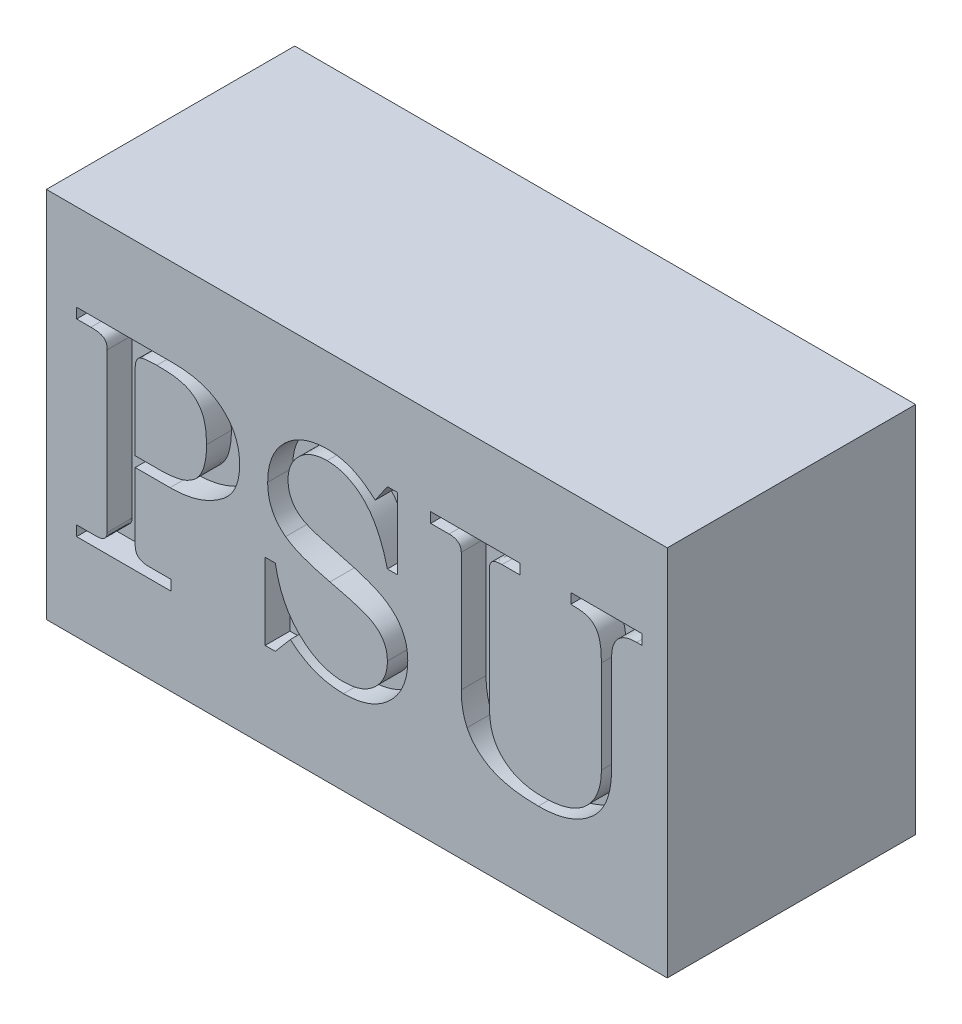
from build123d import *

# Parameters (mm, degrees)
SKETCH1_W           = 125
SKETCH1_H           = 75
BOSS_EXTRUDE1_DEPTH = 50
CUT_EXTRUDE1_DEPTH  = 5


with BuildPart() as part:
    # Sketch1 → Boss-Extrude1 (new body)
    with BuildSketch(Plane.XY):
        Rectangle(SKETCH1_W, SKETCH1_H)
    extrude(amount=BOSS_EXTRUDE1_DEPTH)

    # Sketch2 → Cut-Extrude1 (cut)
    # profile 1 of 3: a face of its own
    with BuildSketch(Plane.XY.offset(50)):
        with BuildLine():
            Line((-56.41025641, 20), (-37.051282051, 20))
            add(Edge.make_bspline(
                [(-37.051282051, 20), (-36.52204216, 19.991527784), (-35.490884744, 19.975020737), (-33.994972237, 19.825630845), (-32.591076027, 19.602688421), (-31.290520247, 19.260853532), (-30.077955268, 18.843022159), (-28.969795206, 18.308646834), (-27.949921272, 17.692552045), (-27.038002375, 16.976842451), (-26.224700836, 16.189326557), (-25.516807248, 15.338512692), (-24.916249962, 14.426315913), (-24.436149481, 13.449757313), (-24.057757456, 12.418278357), (-23.784279991, 11.331135117), (-23.62218601, 10.183833858), (-23.60072252, 9.399564299), (-23.58974359, 8.998397436)],
                knots=[0, 0, 0, 0, 1.292689141, 2.518642334, 3.669783171, 4.7619039, 5.800070599, 6.798316487, 7.761940572, 8.705739108, 9.624107705, 10.523144994, 11.404602814, 12.285964004, 13.175788456, 14.084273311, 15.020074082, 16, 16, 16, 16], degree=3))
            add(Edge.make_bspline(
                [(-23.58974359, 8.998397436), (-23.597484885, 8.599852888), (-23.612509178, 7.826358315), (-23.771679417, 6.702590675), (-24.014646482, 5.651465182), (-24.362474831, 4.669656315), (-24.808778623, 3.759197231), (-25.370177642, 2.929600928), (-26.0195377, 2.165855701), (-26.524459602, 1.727340303), (-26.778846154, 1.506410256)],
                knots=[0, 0, 0, 0, 1.133338588, 2.199581585, 3.222697031, 4.198656778, 5.157148606, 6.099382043, 7.042442712, 8, 8, 8, 8], degree=3))
            add(Edge.make_bspline(
                [(-26.778846154, 1.506410256), (-27.150358384, 1.221318352), (-27.889165368, 0.654370958), (-29.08946605, -0.066788228), (-30.346137315, -0.689408593), (-31.678214602, -1.181553109), (-33.064223912, -1.579982025), (-34.519212096, -1.845841348), (-36.034691561, -2.021242066), (-37.069466616, -2.041149449), (-37.596153846, -2.051282051)],
                knots=[0, 0, 0, 0, 0.966766413, 1.922557917, 2.887448627, 3.860055254, 4.852203204, 5.862987951, 6.912288278, 8, 8, 8, 8], degree=3))
            Line((-37.596153846, -2.051282051), (-44.615384615, -2.051282051))
            Line((-44.615384615, -2.051282051), (-44.615384615, -15.608974359))
            add(Edge.make_bspline(
                [(-44.615384615, -15.608974359), (-44.612226988, -15.794274025), (-44.60634347, -16.139537602), (-44.487520996, -16.611605986), (-44.322036005, -17.015015676), (-44.135541138, -17.213093638), (-44.046474359, -17.307692308)],
                knots=[0, 0, 0, 0, 1.202782543, 2.241110373, 3.159984198, 4, 4, 4, 4], degree=3))
            add(Edge.make_bspline(
                [(-44.046474359, -17.307692308), (-43.911046597, -17.407048231), (-43.637174192, -17.607973397), (-43.147060372, -17.807637756), (-42.596808011, -17.92855606), (-42.206893462, -17.941799617), (-42.003205128, -17.948717949)],
                knots=[0, 0, 0, 0, 0.919900139, 1.860292609, 2.882233465, 4, 4, 4, 4], degree=3))
            Line((-42.003205128, -17.948717949), (-37.435897436, -17.948717949))
            Line((-37.435897436, -17.948717949), (-37.435897436, -20))
            Line((-37.435897436, -20), (-56.41025641, -20))
            Line((-56.41025641, -20), (-56.41025641, -17.948717949))
            Line((-56.41025641, -17.948717949), (-52.5, -17.948717949))
            add(Edge.make_bspline(
                [(-52.5, -17.948717949), (-52.31788663, -17.942981092), (-51.977945195, -17.932272402), (-51.508127412, -17.844687399), (-51.109883004, -17.706842046), (-50.798290496, -17.48857499), (-50.548139659, -17.230180927), (-50.382835969, -16.917682521), (-50.269295945, -16.5702672), (-50.260834083, -16.32311856), (-50.256410256, -16.193910256)],
                knots=[0, 0, 0, 0, 1.349292458, 2.518653158, 3.534106056, 4.446148465, 5.31500813, 6.175016702, 7.045906153, 8, 8, 8, 8], degree=3))
            Line((-50.256410256, -16.193910256), (-50.256410256, 15.649038462))
            add(Edge.make_bspline(
                [(-50.256410256, 15.649038462), (-50.262284827, 15.839474251), (-50.273284612, 16.196053973), (-50.400606449, 16.690389687), (-50.621940945, 17.100165281), (-50.94382327, 17.430681636), (-51.388912675, 17.679735227), (-51.975742244, 17.835364377), (-52.704762346, 17.936923809), (-53.242075145, 17.944569131), (-53.533653846, 17.948717949)],
                knots=[0, 0, 0, 0, 0.983869924, 1.842238094, 2.61559018, 3.368282424, 4.198128383, 5.221597183, 6.492269143, 8, 8, 8, 8], degree=3))
            Line((-53.533653846, 17.948717949), (-56.41025641, 17.948717949))
            Line((-56.41025641, 17.948717949), (-56.41025641, 20))
        make_face()
        with BuildLine():
            Line((-44.615384615, 0), (-39.471153846, 0))
            add(Edge.make_bspline(
                [(-39.471153846, 0), (-39.078206802, 0.004663788), (-38.31753487, 0.01369201), (-37.22115155, 0.124773701), (-36.20612679, 0.275157138), (-35.279619803, 0.511489078), (-34.432482622, 0.801304037), (-33.677385038, 1.173604138), (-33.000162855, 1.599546214), (-32.405821351, 2.100917111), (-31.897341142, 2.689261368), (-31.452431883, 3.35343281), (-31.075101004, 4.103848888), (-30.771637798, 4.943434587), (-30.544007627, 5.868255157), (-30.377635393, 6.875492252), (-30.270824606, 7.96779391), (-30.261331436, 8.725698369), (-30.256410256, 9.118589744)],
                knots=[0, 0, 0, 0, 1.251897863, 2.423439953, 3.509527115, 4.51918943, 5.466945524, 6.357863163, 7.196225829, 8.011580449, 8.826045721, 9.666609894, 10.553695962, 11.496314714, 12.505977028, 13.58503486, 14.748102137, 16, 16, 16, 16], degree=3))
            add(Edge.make_bspline(
                [(-30.256410256, 9.118589744), (-30.259179062, 9.39378111), (-30.2645867, 9.931245872), (-30.315278648, 10.711574103), (-30.385068888, 11.444440249), (-30.484020183, 12.125737673), (-30.634040618, 12.755047645), (-30.798801109, 13.336438661), (-30.987870678, 13.873607107), (-31.299238926, 14.506434423), (-31.751688458, 15.222090642), (-32.408443782, 15.978934541), (-33.196796664, 16.595178015), (-33.939870909, 17.014214114), (-34.608057767, 17.293271866), (-35.195462882, 17.462908648), (-35.856082667, 17.61554425), (-36.59153044, 17.742628507), (-37.402033789, 17.83741919), (-38.287179482, 17.898102484), (-39.249091279, 17.938828986), (-39.917154891, 17.945335683), (-40.264423077, 17.948717949)],
                knots=[0, 0, 0, 0, 1.053875843, 2.058280886, 2.993741376, 3.873391748, 4.692293159, 5.469359816, 6.187785585, 6.869512992, 8.166449872, 9.420392331, 10.687328499, 11.979050363, 12.676259751, 13.456216516, 14.317290157, 15.272565593, 16.313050093, 17.441308487, 18.669958752, 20, 20, 20, 20], degree=3))
            add(Edge.make_bspline(
                [(-40.264423077, 17.948717949), (-40.491446244, 17.947033896), (-40.921598856, 17.943843034), (-41.536827417, 17.924080379), (-42.083761451, 17.871130061), (-42.569626794, 17.822835527), (-42.986054381, 17.739489689), (-43.341639897, 17.652161942), (-43.625345215, 17.526138298), (-43.928189711, 17.363165775), (-44.218194805, 17.06339342), (-44.446691962, 16.60694633), (-44.594363563, 16.05591232), (-44.608046832, 15.655454477), (-44.615384615, 15.440705128)],
                knots=[0, 0, 0, 0, 1.398543777, 2.649893691, 3.789387437, 4.783221821, 5.654418259, 6.404759391, 7.031244983, 7.561816286, 8.515767008, 9.538725498, 10.680118006, 12, 12, 12, 12], degree=3))
            Line((-44.615384615, 15.440705128), (-44.615384615, 0))
        make_face(mode=Mode.SUBTRACT)
    # profile 2 of 3: a face of its own
    with BuildSketch(Plane.XY.offset(50)):
        with BuildLine():
            Line((3.701923077, 16.41025641), (6.153846154, 20))
            Line((6.153846154, 20), (8.205128205, 20))
            Line((8.205128205, 20), (8.205128205, 5.641025641))
            Line((8.205128205, 5.641025641), (6.153846154, 5.641025641))
            add(Edge.make_bspline(
                [(6.153846154, 5.641025641), (6.014720173, 6.179311808), (5.743677627, 7.227990507), (5.26419327, 8.731888364), (4.735810964, 10.123518089), (4.160326861, 11.40146317), (3.535443931, 12.567144603), (2.863961937, 13.624942096), (2.132803608, 14.562887028), (1.361249139, 15.395222104), (0.547313429, 16.11732818), (-0.293147092, 16.749090998), (-1.173676845, 17.267931511), (-2.073863004, 17.707675003), (-3.008821916, 18.045427942), (-3.975297491, 18.285607061), (-4.971342577, 18.434319164), (-5.645858207, 18.452421333), (-5.985576923, 18.461538462)],
                knots=[0, 0, 0, 0, 1.392564724, 2.712967664, 3.951873449, 5.119722724, 6.221370984, 7.262600271, 8.254348041, 9.196438926, 10.101595302, 10.976777585, 11.825919055, 12.65785703, 13.483312273, 14.310934069, 15.149304651, 16, 16, 16, 16], degree=3))
            add(Edge.make_bspline(
                [(-5.985576923, 18.461538462), (-6.266251782, 18.455302295), (-6.818610949, 18.443029718), (-7.626992232, 18.348994358), (-8.395682063, 18.176929329), (-9.126324037, 17.946451231), (-9.818643689, 17.648188369), (-10.473885173, 17.287268778), (-11.083284074, 16.850531061), (-11.64985883, 16.357009981), (-12.157898772, 15.813737068), (-12.611276175, 15.242214959), (-12.998697846, 14.64394813), (-13.304376575, 14.009426851), (-13.546116652, 13.349151471), (-13.722422547, 12.659722843), (-13.830382178, 11.939857185), (-13.840836809, 11.450699764), (-13.846153846, 11.201923077)],
                knots=[0, 0, 0, 0, 1.126750777, 2.217409579, 3.260704063, 4.284866151, 5.288787342, 6.282404548, 7.282136379, 8.292906458, 9.294247238, 10.263909872, 11.218754854, 12.149141496, 13.085441672, 14.037331684, 15.001822113, 16, 16, 16, 16], degree=3))
            add(Edge.make_bspline(
                [(-13.846153846, 11.201923077), (-13.839212922, 10.893880321), (-13.825710997, 10.29465611), (-13.653915038, 9.426813587), (-13.404191768, 8.612629636), (-13.038589376, 7.859599457), (-12.571737243, 7.171098619), (-11.990046511, 6.556699063), (-11.315457131, 6.003472237), (-10.667489582, 5.596855719), (-10.064671005, 5.304838429), (-9.516556115, 5.072016406), (-8.876239323, 4.835627315), (-8.148289335, 4.585013966), (-7.327106786, 4.343156674), (-6.42227416, 4.072217211), (-5.420886063, 3.81324236), (-4.72236587, 3.639872024), (-4.358974359, 3.549679487)],
                knots=[0, 0, 0, 0, 1.100069853, 2.139925311, 3.152029683, 4.138980986, 5.121994753, 6.115535174, 7.15398554, 8.235440347, 8.84210157, 9.54830075, 10.364495047, 11.282859591, 12.301255968, 13.425815379, 14.660830642, 16, 16, 16, 16], degree=3))
            add(Edge.make_bspline(
                [(-4.358974359, 3.549679487), (-3.845847864, 3.420010198), (-2.855319137, 3.169699295), (-1.429715415, 2.788711108), (-0.118501494, 2.402060867), (1.078716006, 2.02082252), (2.165091375, 1.641216199), (3.141455811, 1.279279377), (4.00318921, 0.911243424), (4.980825739, 0.426201353), (6.06487412, -0.202664253), (7.191126788, -1.07821257), (8.150593862, -2.04036847), (8.918962433, -3.113117365), (9.518122128, -4.274471965), (9.957880031, -5.526363409), (10.204356522, -6.88139959), (10.238747632, -7.814200368), (10.256410256, -8.293269231)],
                knots=[0, 0, 0, 0, 1.232165093, 2.378545896, 3.435149422, 4.414474693, 5.303353997, 6.114110724, 6.838339871, 7.483508315, 8.654450536, 9.749016275, 10.7955263, 11.806804694, 12.808015395, 13.828656267, 14.884838868, 16, 16, 16, 16], degree=3))
            add(Edge.make_bspline(
                [(10.256410256, -8.293269231), (10.246137103, -8.723887118), (10.225955873, -9.569819982), (10.052071944, -10.809332411), (9.776459838, -11.995733775), (9.368697372, -13.119988084), (8.866287526, -14.196722657), (8.233330094, -15.206113389), (7.501530818, -16.169258277), (6.655882954, -17.058692935), (5.721198118, -17.865757165), (4.714751715, -18.574505587), (3.645311293, -19.179202069), (2.506851727, -19.671991821), (1.299262912, -20.04505345), (0.028854621, -20.318967924), (-1.307298418, -20.479940307), (-2.219116254, -20.501712882), (-2.684294872, -20.512820513)],
                knots=[0, 0, 0, 0, 1.035674451, 2.034544032, 3.00567608, 3.961072093, 4.906865893, 5.859230957, 6.821991021, 7.813035652, 8.806369794, 9.78881277, 10.770098954, 11.757427494, 12.767644959, 13.806306077, 14.880851562, 16, 16, 16, 16], degree=3))
            add(Edge.make_bspline(
                [(-2.684294872, -20.512820513), (-3.189761667, -20.501037152), (-4.18574886, -20.477818859), (-5.655198302, -20.277315957), (-7.073087116, -19.962355706), (-8.439834606, -19.506092328), (-9.756664997, -18.931125638), (-11.020105157, -18.218092163), (-12.238834885, -17.38549445), (-12.99192251, -16.738161522), (-13.373397436, -16.41025641)],
                knots=[0, 0, 0, 0, 1.034489663, 2.038389989, 3.030740084, 4.004349409, 4.983823211, 5.968063708, 6.970727015, 8, 8, 8, 8], degree=3))
            Line((-13.373397436, -16.41025641), (-16.41025641, -20))
            Line((-16.41025641, -20), (-18.461538462, -20))
            Line((-18.461538462, -20), (-18.461538462, -4.615384615))
            Line((-18.461538462, -4.615384615), (-16.41025641, -4.615384615))
            add(Edge.make_bspline(
                [(-16.41025641, -4.615384615), (-16.311166293, -5.137990502), (-16.117029666, -6.161876097), (-15.69971565, -7.639772051), (-15.217414261, -9.042279604), (-14.629586645, -10.355408738), (-13.96439328, -11.586094519), (-13.216477606, -12.734788371), (-12.373366703, -13.791284419), (-11.452569403, -14.760624761), (-10.47440684, -15.626243333), (-9.461740671, -16.387193742), (-8.412401394, -17.026274216), (-7.331307636, -17.543354828), (-6.224111515, -17.963423587), (-5.08057737, -18.246173403), (-3.908336051, -18.432011231), (-3.115026851, -18.451662592), (-2.716346154, -18.461538462)],
                knots=[0, 0, 0, 0, 1.203557391, 2.358000753, 3.472814881, 4.558186921, 5.610607053, 6.636911962, 7.656713516, 8.666011679, 9.659686897, 10.610151865, 11.529909132, 12.435830157, 13.319692086, 14.205413257, 15.098123285, 16, 16, 16, 16], degree=3))
            add(Edge.make_bspline(
                [(-2.716346154, -18.461538462), (-2.398280862, -18.452571409), (-1.773809946, -18.43496602), (-0.858265084, -18.334348631), (0.012702628, -18.147146772), (0.839388467, -17.891724373), (1.624006715, -17.564845772), (2.353124248, -17.148195691), (3.05035053, -16.678441471), (3.683242008, -16.12561924), (4.258573471, -15.526709904), (4.767807403, -14.894092098), (5.193639928, -14.223103267), (5.550165306, -13.524588131), (5.823810252, -12.790533505), (6.015362347, -12.027289636), (6.130138489, -11.232110682), (6.145836769, -10.692155852), (6.153846154, -10.416666667)],
                knots=[0, 0, 0, 0, 1.141184085, 2.24053454, 3.298523207, 4.331930668, 5.340931447, 6.340425213, 7.339689331, 8.351914852, 9.348050511, 10.316191482, 11.259745609, 12.193863714, 13.124634419, 14.063457944, 15.01196107, 16, 16, 16, 16], degree=3))
            add(Edge.make_bspline(
                [(6.153846154, -10.416666667), (6.143483181, -10.108745992), (6.123224069, -9.50677589), (5.952285041, -8.631141375), (5.662543357, -7.815834971), (5.255805447, -7.058409963), (4.728765578, -6.361513051), (4.068086926, -5.726665258), (3.263879327, -5.171153297), (2.493442764, -4.751229359), (1.770406451, -4.42607241), (1.095124515, -4.172650446), (0.301756356, -3.912770728), (-0.608523028, -3.630047378), (-1.63696737, -3.335787431), (-2.789227236, -3.032157823), (-4.057381028, -2.711629359), (-4.946232654, -2.503902387), (-5.408653846, -2.395833333)],
                knots=[0, 0, 0, 0, 0.958725222, 1.874261679, 2.766509533, 3.645150004, 4.542196588, 5.477931134, 6.486874257, 7.578017349, 8.207475951, 8.95547135, 9.823846098, 10.80822927, 11.924964205, 13.156213188, 14.52053228, 16, 16, 16, 16], degree=3))
            add(Edge.make_bspline(
                [(-5.408653846, -2.395833333), (-5.919481946, -2.270257685), (-6.904188029, -2.028189748), (-8.31847885, -1.635400347), (-9.616200801, -1.230734776), (-10.793741131, -0.804943975), (-11.856316818, -0.377345776), (-12.793534445, 0.072956892), (-13.621760515, 0.523762058), (-14.110521887, 0.863893873), (-14.342948718, 1.025641026)],
                knots=[0, 0, 0, 0, 1.311989861, 2.529078561, 3.660524616, 4.701531557, 5.651641921, 6.51576602, 7.294183583, 8, 8, 8, 8], degree=3))
            add(Edge.make_bspline(
                [(-14.342948718, 1.025641026), (-14.629246444, 1.256868185), (-15.195129366, 1.713901159), (-15.931957032, 2.503659275), (-16.56095921, 3.362434111), (-17.061576487, 4.299291492), (-17.471016452, 5.298268336), (-17.746042861, 6.37421358), (-17.918989987, 7.518399719), (-17.938639326, 8.305971302), (-17.948717949, 8.709935897)],
                knots=[0, 0, 0, 0, 1.000126293, 1.976803651, 2.928762077, 3.887903112, 4.859377268, 5.858658592, 6.90165398, 8, 8, 8, 8], degree=3))
            add(Edge.make_bspline(
                [(-17.948717949, 8.709935897), (-17.936846567, 9.132352706), (-17.913551494, 9.961256205), (-17.763113962, 11.17519074), (-17.497108424, 12.332450589), (-17.120749138, 13.426838537), (-16.643432426, 14.467617259), (-16.057906224, 15.445776707), (-15.361874263, 16.364330471), (-14.571658338, 17.219551246), (-13.695289038, 17.991386634), (-12.753651248, 18.668669299), (-11.753098989, 19.243050089), (-10.691075248, 19.707079383), (-9.569384644, 20.071377248), (-8.387336154, 20.321120884), (-7.149690337, 20.491169831), (-6.304012234, 20.505515682), (-5.873397436, 20.512820513)],
                knots=[0, 0, 0, 0, 1.070268323, 2.100174846, 3.093319402, 4.073467769, 5.027260625, 5.989371598, 6.955733259, 7.942215445, 8.934691163, 9.909381139, 10.876334984, 11.8520346, 12.840742565, 13.858820071, 14.909722553, 16, 16, 16, 16], degree=3))
            add(Edge.make_bspline(
                [(-5.873397436, 20.512820513), (-5.453412253, 20.502985724), (-4.622988057, 20.483539688), (-3.393629316, 20.299195909), (-2.196302515, 20.003668978), (-1.019010098, 19.582136122), (0.148904856, 19.016847232), (1.332356951, 18.308824432), (2.526052282, 17.427656182), (3.300469149, 16.757606762), (3.701923077, 16.41025641)],
                knots=[0, 0, 0, 0, 0.943425551, 1.865407251, 2.787037101, 3.711770321, 4.670334693, 5.698831597, 6.80708552, 8, 8, 8, 8], degree=3))
        make_face()
    # profile 3 of 3: a face of its own
    with BuildSketch(Plane.XY.offset(50)):
        with BuildLine():
            Line((14.871794872, 20), (32.820512821, 20))
            Line((32.820512821, 20), (32.820512821, 17.948717949))
            Line((32.820512821, 17.948717949), (29.246794872, 17.948717949))
            add(Edge.make_bspline(
                [(29.246794872, 17.948717949), (29.02492948, 17.942524767), (28.616509209, 17.931124066), (28.05182458, 17.851892946), (27.595415655, 17.691740305), (27.230545775, 17.475086601), (26.970912309, 17.176648198), (26.7933029, 16.817918082), (26.678427752, 16.398523834), (26.670707375, 16.09589209), (26.666666667, 15.9375)],
                knots=[0, 0, 0, 0, 1.410657382, 2.596804593, 3.606280207, 4.468228395, 5.261943752, 6.081912073, 6.996106781, 8, 8, 8, 8], degree=3))
            Line((26.666666667, 15.9375), (26.666666667, -7.043269231))
            add(Edge.make_bspline(
                [(26.666666667, -7.043269231), (26.667249256, -7.334447628), (26.668377417, -7.898302856), (26.704218314, -8.7183464), (26.747620897, -9.483044131), (26.820240846, -10.194117125), (26.915092689, -10.846299842), (27.029455062, -11.444528863), (27.150699426, -11.990244271), (27.262363671, -12.329788557), (27.315705128, -12.491987179)],
                knots=[0, 0, 0, 0, 1.26811646, 2.4556564, 3.574661788, 4.603759325, 5.56787581, 6.444033903, 7.256722706, 8, 8, 8, 8], degree=3))
            add(Edge.make_bspline(
                [(27.315705128, -12.491987179), (27.399858317, -12.715373224), (27.566173915, -13.156860758), (27.885402167, -13.788577457), (28.251413878, -14.386993374), (28.669019035, -14.950984391), (29.141123024, -15.473555339), (29.650134839, -15.972141092), (30.217773657, -16.430709978), (30.831457676, -16.855432148), (31.499721364, -17.23248384), (32.215806359, -17.560212791), (32.980165056, -17.845593895), (33.798451877, -18.059698438), (34.659278806, -18.255593236), (35.572405855, -18.362122029), (36.531345933, -18.452219526), (37.187247642, -18.458376826), (37.524038462, -18.461538462)],
                knots=[0, 0, 0, 0, 0.903387022, 1.785402976, 2.675270515, 3.557228478, 4.438316115, 5.339549109, 6.252566374, 7.198003933, 8.162720635, 9.153798285, 10.177771895, 11.247573044, 12.354500056, 13.517444542, 14.725263443, 16, 16, 16, 16], degree=3))
            add(Edge.make_bspline(
                [(37.524038462, -18.461538462), (37.986399479, -18.451448951), (38.883567978, -18.431871194), (40.188803475, -18.305379955), (41.410215163, -18.085731137), (42.544503035, -17.759666398), (43.602102249, -17.365811625), (44.568576145, -16.865302068), (45.449652698, -16.276003059), (46.246019217, -15.601627572), (46.948542016, -14.847895972), (47.562656007, -14.034969866), (48.080473351, -13.158575048), (48.505798196, -12.224635779), (48.823914135, -11.222106505), (49.068480123, -10.167622987), (49.201648598, -9.047200067), (49.220925658, -8.282905167), (49.230769231, -7.892628205)],
                knots=[0, 0, 0, 0, 1.240146847, 2.40638947, 3.513665422, 4.563674902, 5.568218463, 6.535885627, 7.475731, 8.405887694, 9.328370406, 10.233922815, 11.133304582, 12.053503296, 12.980121789, 13.949908244, 14.953148082, 16, 16, 16, 16], degree=3))
            Line((49.230769231, -7.892628205), (49.230769231, 10.793269231))
            add(Edge.make_bspline(
                [(49.230769231, 10.793269231), (49.22467354, 11.180549438), (49.213231905, 11.907475862), (49.168843819, 12.925301059), (49.054094137, 13.791687371), (48.912512518, 14.524267081), (48.727385135, 15.144694118), (48.500393719, 15.681390404), (48.239467793, 16.150849741), (47.928378687, 16.547638829), (47.587568757, 16.890506628), (47.206156773, 17.183832655), (46.778474707, 17.422619718), (46.291084136, 17.625362706), (45.701930957, 17.779120133), (44.967945534, 17.874488768), (44.076905134, 17.935853941), (43.426944661, 17.944215188), (43.076923077, 17.948717949)],
                knots=[0, 0, 0, 0, 1.655382009, 3.107158339, 4.350182702, 5.386595163, 6.292911568, 7.111223447, 7.872887823, 8.580646933, 9.258603051, 9.934345665, 10.629475154, 11.345924362, 12.184832845, 13.222752633, 14.504375938, 16, 16, 16, 16], degree=3))
            Line((43.076923077, 17.948717949), (43.076923077, 20))
            Line((43.076923077, 20), (57.435897436, 20))
            Line((57.435897436, 20), (57.435897436, 17.948717949))
            Line((57.435897436, 17.948717949), (56.346153846, 17.948717949))
            add(Edge.make_bspline(
                [(56.346153846, 17.948717949), (55.946999366, 17.932151756), (55.193394492, 17.900874733), (54.132933508, 17.659986894), (53.239098729, 17.218758888), (52.500804249, 16.614598265), (51.947700809, 15.832688725), (51.552858878, 14.907556409), (51.323435789, 13.830395208), (51.296356014, 13.064719903), (51.282051282, 12.66025641)],
                knots=[0, 0, 0, 0, 1.143632929, 2.159182456, 3.090305203, 3.976285122, 4.864345778, 5.807131269, 6.841629942, 8, 8, 8, 8], degree=3))
            Line((51.282051282, 12.66025641), (51.282051282, -6.866987179))
            add(Edge.make_bspline(
                [(51.282051282, -6.866987179), (51.272676029, -7.385696385), (51.254447171, -8.394253242), (51.073436927, -9.858070045), (50.786686939, -11.22875486), (50.390338068, -12.510183782), (49.863893876, -13.695967371), (49.230524982, -14.793462755), (48.476336796, -15.797885185), (47.88419813, -16.382422768), (47.588141026, -16.674679487)],
                knots=[0, 0, 0, 0, 1.152855769, 2.241565367, 3.273531455, 4.263370668, 5.217893992, 6.151931318, 7.076003826, 8, 8, 8, 8], degree=3))
            add(Edge.make_bspline(
                [(47.588141026, -16.674679487), (47.233330521, -16.981073887), (46.524517631, -17.59316484), (45.353492508, -18.383982246), (44.09123708, -19.037040649), (42.747042595, -19.578419082), (41.320809385, -20.00489151), (39.803513337, -20.293389641), (38.204818932, -20.487382548), (37.107978324, -20.504207394), (36.546474359, -20.512820513)],
                knots=[0, 0, 0, 0, 0.939075724, 1.876012599, 2.824260626, 3.782610436, 4.776892046, 5.802671179, 6.875124758, 8, 8, 8, 8], degree=3))
            add(Edge.make_bspline(
                [(36.546474359, -20.512820513), (36.062901674, -20.509215896), (35.119088573, -20.502180585), (33.7452846, -20.418477702), (32.450533253, -20.29489133), (31.235873331, -20.111120241), (30.099284615, -19.871146103), (29.041334849, -19.58557687), (28.062421195, -19.249201301), (27.163406164, -18.855386275), (26.332391843, -18.413919124), (25.566449304, -17.919230575), (24.852021482, -17.386446959), (24.2017739, -16.80009911), (23.615665756, -16.167878665), (23.070756251, -15.504223849), (22.599732434, -14.780505781), (22.330537557, -14.270323859), (22.195512821, -14.014423077)],
                knots=[0, 0, 0, 0, 1.392728927, 2.718259004, 3.963026708, 5.138156251, 6.254759271, 7.307402733, 8.292811661, 9.233349635, 10.13168815, 11.000279165, 11.857345163, 12.696262757, 13.518180364, 14.338836724, 15.166781568, 16, 16, 16, 16], degree=3))
            add(Edge.make_bspline(
                [(22.195512821, -14.014423077), (22.011830586, -13.594137272), (21.631388554, -12.723642713), (21.293604722, -11.276987612), (21.05813994, -9.690011732), (21.036785407, -8.577425156), (21.025641026, -7.996794872)],
                knots=[0, 0, 0, 0, 0.889031398, 1.841358869, 2.873460781, 4, 4, 4, 4], degree=3))
            Line((21.025641026, -7.996794872), (21.025641026, 15.985576923))
            add(Edge.make_bspline(
                [(21.025641026, 15.985576923), (21.017808191, 16.13047448), (21.002753623, 16.408964991), (20.891752009, 16.803632497), (20.689398956, 17.144582049), (20.413589968, 17.435380293), (20.05937524, 17.673196235), (19.627499908, 17.839368784), (19.119943338, 17.933232987), (18.758433932, 17.943333264), (18.565705128, 17.948717949)],
                knots=[0, 0, 0, 0, 0.97408065, 1.872165578, 2.725488051, 3.614909578, 4.546496845, 5.57047121, 6.704763496, 8, 8, 8, 8], degree=3))
            Line((18.565705128, 17.948717949), (14.871794872, 17.948717949))
            Line((14.871794872, 17.948717949), (14.871794872, 20))
        make_face()
    extrude(amount=-CUT_EXTRUDE1_DEPTH, mode=Mode.SUBTRACT)


solid = part.part
